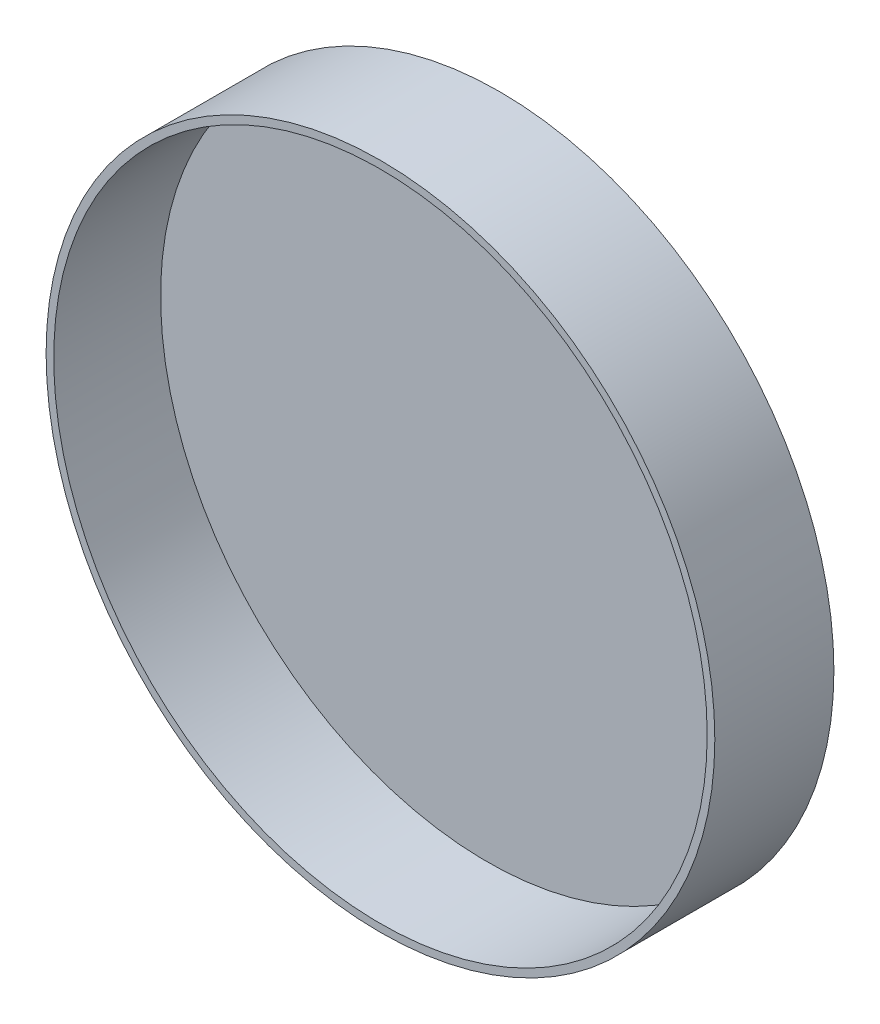
from build123d import *

# Parameters (mm, degrees)
SKETCH1_R      = 21.9
EXTRUDE1_DEPTH = 0.8
SKETCH2_R      = 21.9
SKETCH2_R_2    = 21.4
EXTRUDE2_DEPTH = 7
SKETCH4_R      = 2
EXTRUDE4_DEPTH = 10


with BuildPart() as part:
    # Sketch1 → Extrude1 (new body)
    with BuildSketch(Plane.XY):
        Circle(SKETCH1_R)
    extrude(amount=EXTRUDE1_DEPTH)

    # Sketch2 → Extrude2 (add)
    with BuildSketch(Plane.XY.offset(0.8)):
        Circle(SKETCH2_R)
        Circle(SKETCH2_R_2, mode=Mode.SUBTRACT)
    extrude(amount=EXTRUDE2_DEPTH)

    # Sketch4 → Extrude4 (add)
    with BuildSketch(Plane.XY.offset(0.8)):
        Circle(SKETCH4_R)
    extrude(amount=-EXTRUDE4_DEPTH)


solid = part.part
